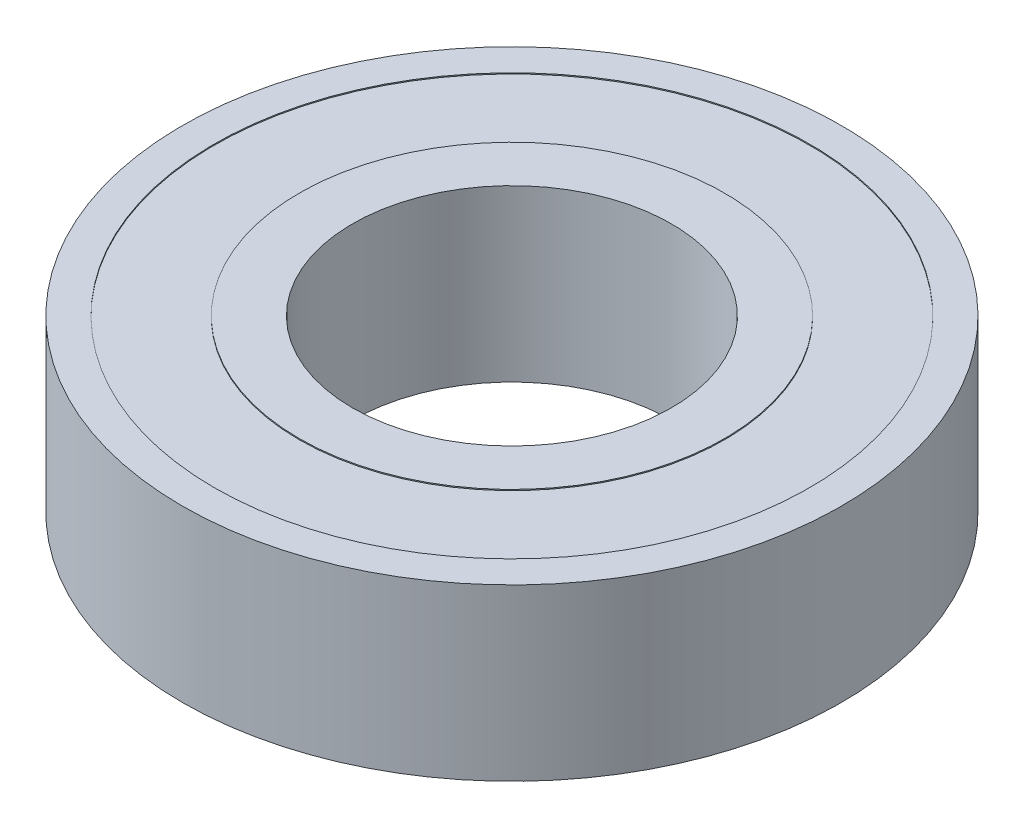
from build123d import *

# Parameters (mm, degrees)
SKETCH1_R           = 31
SKETCH1_R_2         = 15
BOSS_EXTRUDE2_DEPTH = 8
SKETCH4_R           = 28
SKETCH4_R_2         = 20
CUT_EXTRUDE2_DEPTH  = 0.1


with BuildPart() as part:
    # Sketch1 → Boss-Extrude2 (new body)
    with BuildSketch(Plane(origin=(0, 0, 0), x_dir=(1, 0, 0), z_dir=(0, 1, 0))):
        with Locations(Location((0, 0, 0), (0, 0, 270))):
            Circle(SKETCH1_R)
        with Locations(Location((0, 0, 0), (0, 0, 270))):
            Circle(SKETCH1_R_2, mode=Mode.SUBTRACT)
    boss_extrude2 = extrude(amount=BOSS_EXTRUDE2_DEPTH)

    # Sketch4 → Cut-Extrude2 (cut)
    with BuildSketch(Plane(origin=(0, 8, 0), x_dir=(1, 0, 0), z_dir=(0, 1, 0))):
        with Locations(Location((0, 0, 0), (0, 0, 270))):
            Circle(SKETCH4_R)
        with Locations(Location((0, 0, 0), (0, 0, 270))):
            Circle(SKETCH4_R_2, mode=Mode.SUBTRACT)
    cut_extrude2 = extrude(amount=-CUT_EXTRUDE2_DEPTH, mode=Mode.SUBTRACT)


with BuildPart() as mirror2_1:
    # Mirror2: Boss-Extrude2 across Top Plane
    add(boss_extrude2.mirror(Plane(origin=(0, 0, 0), x_dir=(1, 0, 0), z_dir=(0, 1, 0))))

    # Mirror2 2: Cut-Extrude2 across Top Plane
    add(cut_extrude2.mirror(Plane(origin=(0, 0, 0), x_dir=(1, 0, 0), z_dir=(0, 1, 0))), mode=Mode.SUBTRACT)


with BuildPart() as part_1:
    add(part.part)

    # Mirror2 united with what the copies touc: union Mirror2_1
    add(mirror2_1.part)


solid = part_1.part
